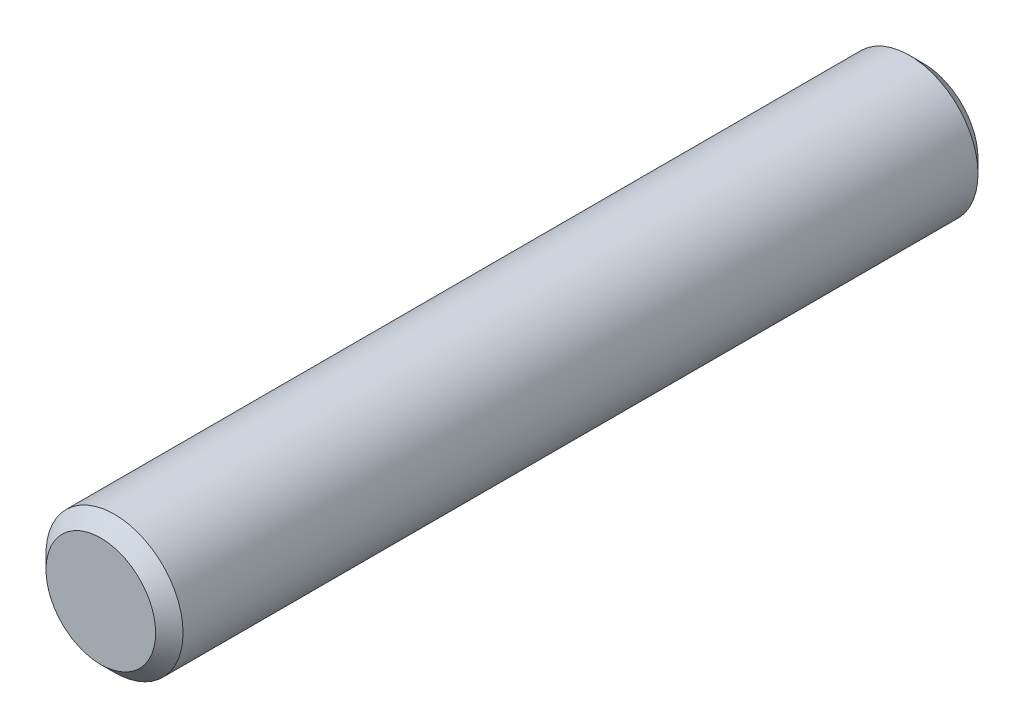
from build123d import *

# Parameters (mm, degrees)
SKETCH_1_R      = 2.5
EXTRUDE_1_DEPTH = 15
CHAMFER_1_SIZE  = 0.5


with BuildPart() as part:
    # 草图1 → 凸台-拉伸1 (new, symmetric)
    with BuildSketch(Plane.XY):
        Circle(SKETCH_1_R)
    extrude(amount=EXTRUDE_1_DEPTH, both=True)

    # 倒角1
    chamfer_1_edges = [part.edges().sort_by_distance(p)[0] for p in [
        (-2.5, 0, -15),
        (-2.5, 0, 15),
    ]]
    chamfer(chamfer_1_edges, length=CHAMFER_1_SIZE)


solid = part.part
